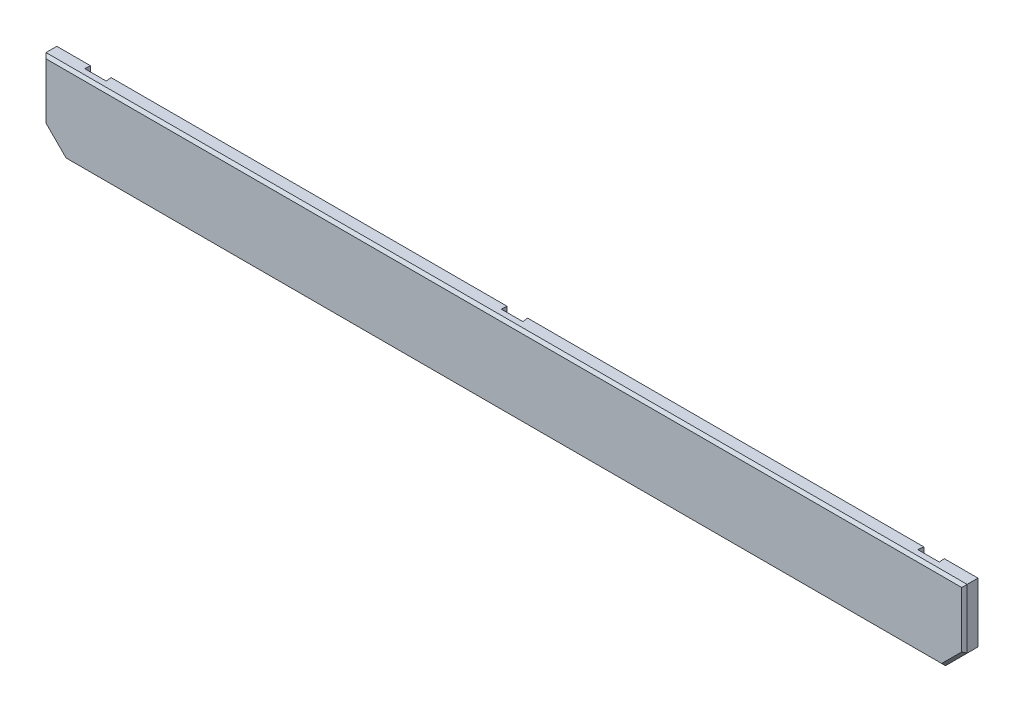
from build123d import *

# Parameters (mm, degrees)
ESQUISSE1_W                  = 1700
ESQUISSE1_H                  = 150
BOSS_EXTRU_1_DEPTH           = 25
ENL_V_MAT_EXTRU_1_DEPTH      = 1707.78791887
ENL_V_MAT_EXTRU_1_DEPTH_BACK = 1707.78791887
CHANFREIN2_SIZE              = 40
CHANFREIN3_SIZE              = 5


with BuildPart() as part:
    # Esquisse1 → Boss.-Extru.1 (new body)
    with BuildSketch(Plane.XY):
        with Locations((850, 75)):
            Rectangle(ESQUISSE1_W, ESQUISSE1_H)
    extrude(amount=BOSS_EXTRU_1_DEPTH)

    # Esquisse2 → Enlèv. mat.-Extru.1 (cut, two sides: drawn at the far end of the back side and taken through both)
    with BuildSketch(Plane(origin=(0, 150, 0), x_dir=(1, 0, 0), z_dir=(0, 1, 0)).offset(-ENL_V_MAT_EXTRU_1_DEPTH_BACK)):
        Polygon((100, 0), (101.227845609, -10), (61.227845609, -10), (62.455691218, 0), align=None)
        Polygon((1637.544308782, 0), (1638.772154391, -10), (1598.772154391, -10), (1600, 0), align=None)
        Polygon((868.772154391, 0), (831.227845609, 0), (830, -10), (870, -10), align=None)
    extrude(amount=ENL_V_MAT_EXTRU_1_DEPTH + ENL_V_MAT_EXTRU_1_DEPTH_BACK, mode=Mode.SUBTRACT)

    # Chanfrein2
    chanfrein2_edges = [part.edges().sort_by_distance(p)[0] for p in [
        (1700, 0, 12.5),
        (0, 0, 12.5),
    ]]
    chamfer(chanfrein2_edges, length=CHANFREIN2_SIZE)

    # Chanfrein3
    chanfrein3_edges = [part.edges().sort_by_distance(p)[0] for p in [
        (850, 150, 25),
        (0, 95, 25),
        (850, 0, 25),
        (1700, 95, 25),
        (1680, 20, 25),
        (20, 20, 25),
    ]]
    chamfer(chanfrein3_edges, length=CHANFREIN3_SIZE)


solid = part.part
